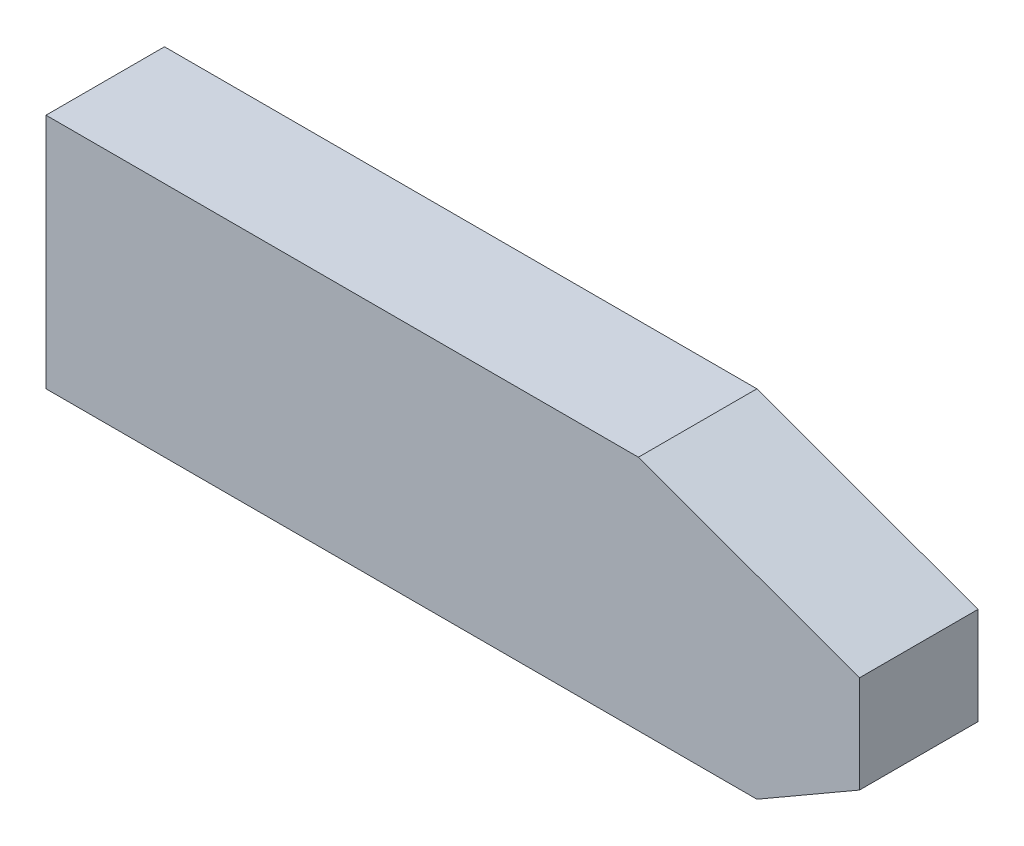
from build123d import *

# Parameters (mm, degrees)
BOSS_EXTRUDE1_DEPTH = 25.4


with BuildPart() as part:
    # Sketch2 → Boss-Extrude1 (new body)
    with BuildSketch(Plane.XY):
        Polygon((0, 0), (152.4, 0), (174.397045256, 12.7), (174.397045256, 33.548886335), (127, 50.8), (0, 50.8), align=None)
    extrude(amount=BOSS_EXTRUDE1_DEPTH)


solid = part.part
